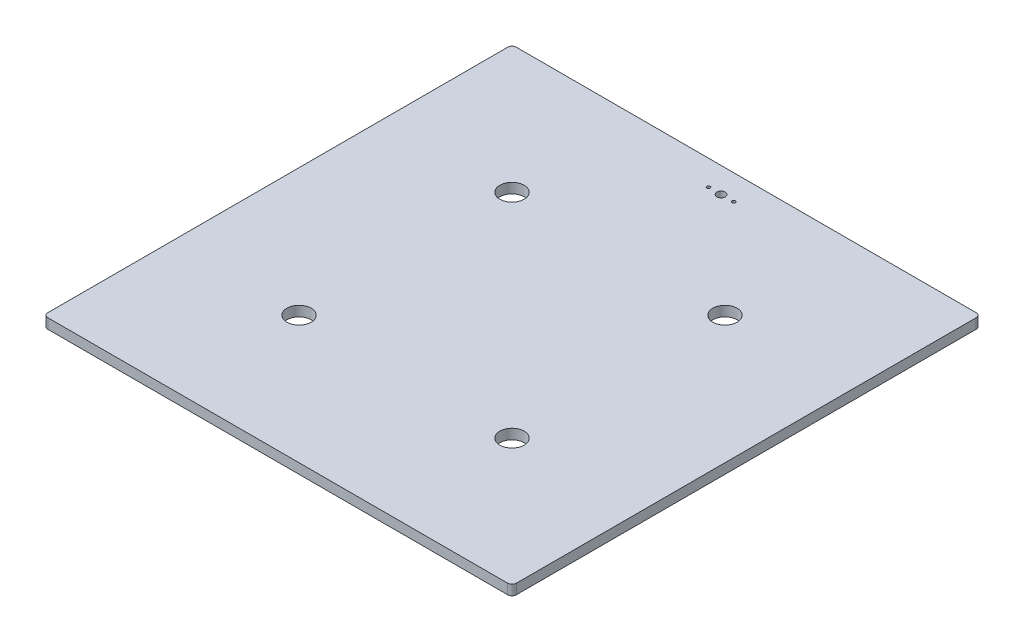
from build123d import *

# Parameters (mm, degrees)
SKETCH1_W           = 279.4
SKETCH1_H           = 279.4
BOSS_EXTRUDE1_DEPTH = 5.9944
SKETCH2_R           = 7.25
CUT_EXTRUDE1_DEPTH  = 198.656552715
FILLET1_R           = 2.54
SKETCH3_R           = 1
CUT_EXTRUDE2_DEPTH  = 198.656552715


with BuildPart() as part:
    # Sketch1 → Boss-Extrude1 (new body)
    with BuildSketch(Plane(origin=(0, 0, 0), x_dir=(1, 0, 0), z_dir=(0, 1, 0))):
        Rectangle(SKETCH1_W, SKETCH1_H)
    extrude(amount=BOSS_EXTRUDE1_DEPTH)

    # Sketch2 → Cut-Extrude1 (cut, through all)
    with BuildSketch(Plane(origin=(0, 5.9944, 0), x_dir=(1, 0, 0), z_dir=(0, 1, 0))):
        with Locations(Location((-63.5, 63.5, 0), (0, 0, 270))):
            Circle(SKETCH2_R)
        with Locations(Location((63.5, 63.5, 0), (0, 0, 270))):
            Circle(SKETCH2_R)
        with Locations(Location((63.5, -63.5, 0), (0, 0, 270))):
            Circle(SKETCH2_R)
        with Locations(Location((-63.5, -63.5, 0), (0, 0, 270))):
            Circle(SKETCH2_R)
    extrude(amount=-CUT_EXTRUDE1_DEPTH, mode=Mode.SUBTRACT)

    # Fillet1
    fillet1_edges = [part.edges().sort_by_distance(p)[0] for p in [
        (139.7, 2.9972, 139.7),
        (-139.7, 2.9972, 139.7),
        (-139.7, 2.9972, -139.7),
        (139.7, 2.9972, -139.7),
    ]]
    fillet(fillet1_edges, radius=FILLET1_R)

    # Sketch3 → Cut-Extrude2 (cut, through all)
    with BuildSketch(Plane(origin=(0, 5.9944, 0), x_dir=(1, 0, 0), z_dir=(0, 1, 0))):
        with BuildLine():
            ThreePointArc((2.5, 124.7), (0, 127.2), (-2.5, 124.7))
            Line((-2.5, 124.7), (2.5, 124.7))
        make_face()
        with BuildLine():
            Line((2.5, 124.7), (-2.5, 124.7))
            ThreePointArc((-2.5, 124.7), (0, 122.2), (2.5, 124.7))
        make_face()
        with Locations(Location((7.5, 124.7, 0), (0, 0, 270))):
            Circle(SKETCH3_R)
        with Locations(Location((-7.5, 124.7, 0), (0, 0, 270))):
            Circle(SKETCH3_R)
    extrude(amount=-CUT_EXTRUDE2_DEPTH, mode=Mode.SUBTRACT)


solid = part.part
